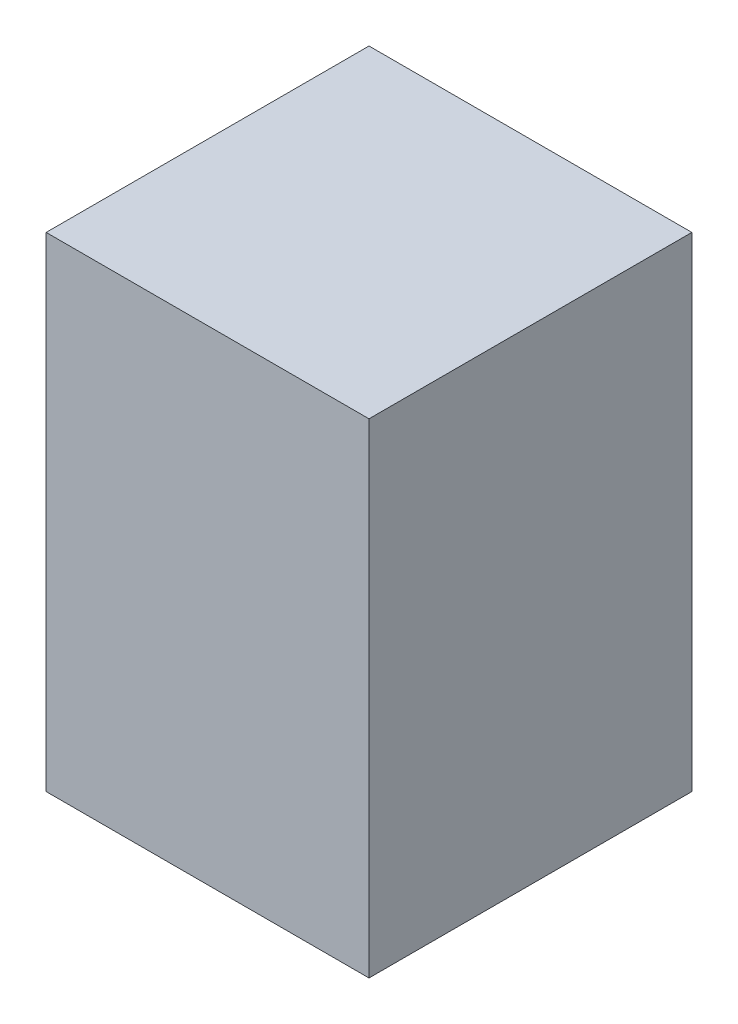
from build123d import *

# Parameters (mm, degrees)
PRESS_AYAK_2_1_START = -40
SKETCH1_W            = 80
SKETCH1_H            = 120
PRESS_AYAK_2_1_DEPTH = 80


with BuildPart() as part:
    # Sketch1 → PRESS_ayak_2_1 (new body)
    with BuildSketch(Plane.XY.offset(PRESS_AYAK_2_1_START)):
        with Locations((600, 60)):
            Rectangle(SKETCH1_W, SKETCH1_H)
    extrude(amount=-PRESS_AYAK_2_1_DEPTH)


solid = part.part
